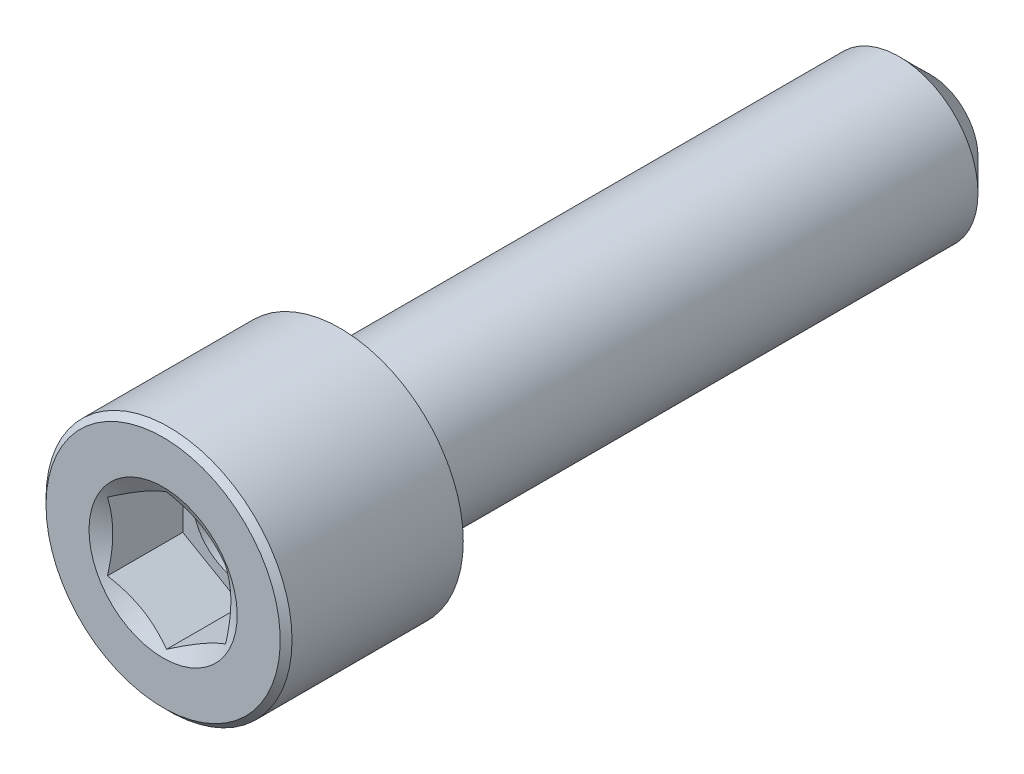
from build123d import *

# Parameters (mm, degrees)
CHAMFER_1_SIZE      = 1.6
CHAMFER_2_SIZE      = 0.3
FILLET_1_R          = 0.5
CUT_EXTRUDE_1_DEPTH = 4


with BuildPart() as part:
    # Эскиз1 → Повернуть1 (revolve)
    with BuildSketch(Plane(origin=(0, 0, 0), x_dir=(0, 0, -1), z_dir=(1, 0, 0)), mode=Mode.PRIVATE) as revolve_1_sk:
        Polygon((21.792576246, 0), (21.792576246, 4), (-8.207423754, 4), (-8.207423754, 6.25), (-17.207423754, 6.25), (-17.207423754, 0), align=None)
    revolve(revolve_1_sk.sketch.rotate(Axis((0, 0, 17.207423754), (0, 0, -1)), 90), axis=Axis((0, 0, 17.207423754), (0, 0, -1)))

    # Фаска1
    chamfer_1_edges = [part.edges().sort_by_distance(p)[0] for p in [
        (-4, 0, -21.792576246),
    ]]
    chamfer(chamfer_1_edges, length=CHAMFER_1_SIZE)

    # Фаска2
    chamfer_2_edges = [part.edges().sort_by_distance(p)[0] for p in [
        (-6.25, 0, 17.207423754),
    ]]
    chamfer(chamfer_2_edges, length=CHAMFER_2_SIZE)

    # Скругление1
    fillet_1_edges = [part.edges().sort_by_distance(p)[0] for p in [
        (-4, 0, 8.207423754),
    ]]
    fillet(fillet_1_edges, radius=FILLET_1_R)

    # Эскиз3 → Вырез-Вытянуть1 (cut)
    with BuildSketch(Plane.XY.offset(17.207423754)):
        Polygon((0, 3.464101615), (-3, 1.732050808), (-3, -1.732050808), (0, -3.464101615), (3, -1.732050808), (3, 1.732050808), align=None)
    extrude(amount=-CUT_EXTRUDE_1_DEPTH, mode=Mode.SUBTRACT)

    # Эскиз4 → Вырез-Повернуть2 (revolve, cut)
    with BuildSketch(Plane(origin=(0, 0, 0), x_dir=(0, 0, -1), z_dir=(1, 0, 0)), mode=Mode.PRIVATE) as cut_revolve_2_sk:
        Polygon((-17.207423754, 3.764101615), (-17.207423754, 1.732050808), (-16.034218673, 1.732050808), align=None)
    revolve(cut_revolve_2_sk.sketch.rotate(Axis((0, 0, 17.207423754), (0, 0, -1)), 270), axis=Axis((0, 0, 17.207423754), (0, 0, -1)), mode=Mode.SUBTRACT)

    # Эскиз6 → Вырез-Повернуть3 (revolve, cut)
    with BuildSketch(Plane(origin=(0, 0, 0), x_dir=(0, 0, -1), z_dir=(1, 0, 0)), mode=Mode.PRIVATE) as cut_revolve_3_sk:
        Polygon((-13.207423754, 0), (-13.207423754, 2.5), (-12.207423754, 2.5), (-9.707423754, 0), align=None)
    revolve(cut_revolve_3_sk.sketch.rotate(Axis((0, 0, 0), (0, 0, 1)), 90), axis=Axis((0, 0, 0), (0, 0, 1)), mode=Mode.SUBTRACT)


solid = part.part
